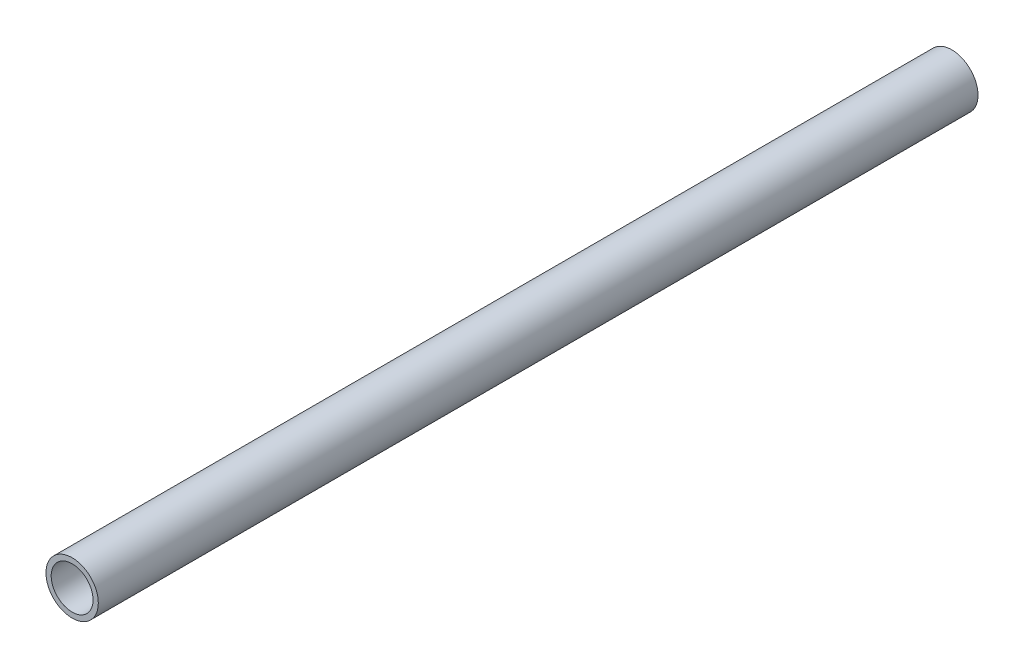
from build123d import *

# Parameters (mm, degrees)
SKETCH1_R           = 15.875
SKETCH1_R_2         = 12.7
BOSS_EXTRUDE1_DEPTH = 533.4


with BuildPart() as part:
    # Sketch1 → Boss-Extrude1 (new body)
    with BuildSketch(Plane.XY):
        Circle(SKETCH1_R)
        Circle(SKETCH1_R_2, mode=Mode.SUBTRACT)
    extrude(amount=BOSS_EXTRUDE1_DEPTH)


solid = part.part
